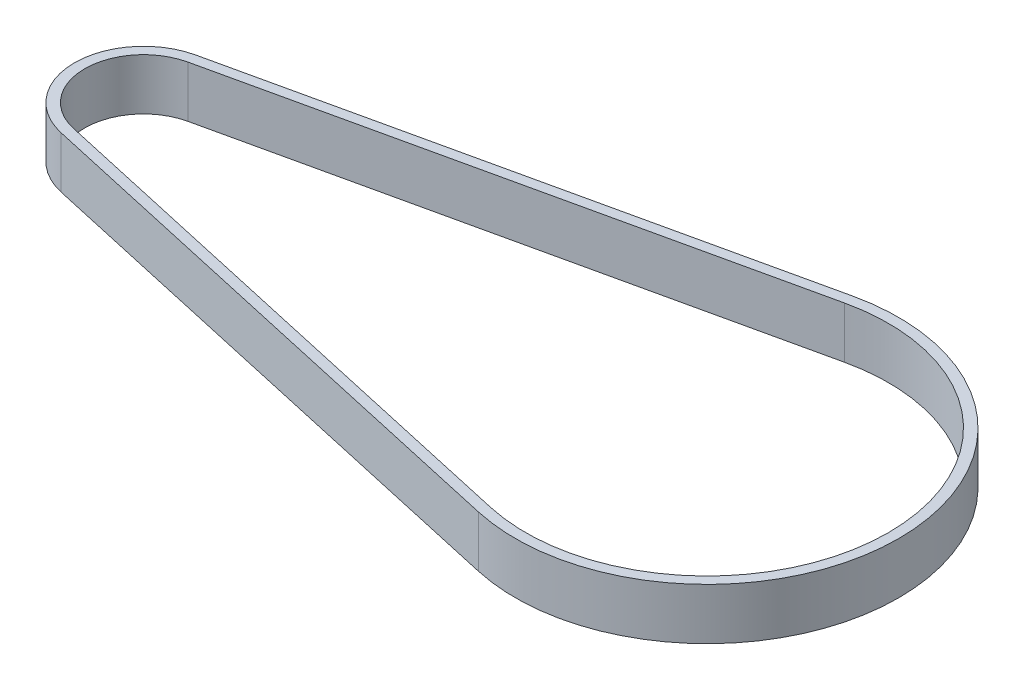
from build123d import *

# Parameters (mm, degrees)
LINEAR_AUSTRAGEN_D_NN1_DEPTH      = 2
LINEAR_AUSTRAGEN_D_NN1_DEPTH_BACK = 2


with BuildPart() as part:
    # Skizze1 → Linear-Austragen-Dünn1 (new, two sides: drawn at the far end of the back side and taken through both)
    with BuildSketch(Plane(origin=(0, 0, 0), x_dir=(1, 0, 0), z_dir=(0, 1, 0)).offset(-LINEAR_AUSTRAGEN_D_NN1_DEPTH_BACK)):
        with BuildLine():
            Line((40.65321754, -14.567567699), (-1.169276765, -5.246276474))
            ThreePointArc((-1.169276765, -5.246276474), (-5.375, 0), (-1.169276765, 5.246276474))
            Line((-1.169276765, 5.246276474), (40.65321754, 14.567567699))
            ThreePointArc((40.65321754, 14.567567699), (58.825, 0), (40.65321754, -14.567567699))
        make_face()
        with BuildLine():
            Line((40.827249431, -13.786726549), (-0.995244875, -4.465435325))
            ThreePointArc((-0.995244875, -4.465435325), (-4.575, 0), (-0.995244875, 4.465435325))
            Line((-0.995244875, 4.465435325), (40.827249431, 13.786726549))
            ThreePointArc((40.827249431, 13.786726549), (58.025, 0), (40.827249431, -13.786726549))
        make_face(mode=Mode.SUBTRACT)
    extrude(amount=LINEAR_AUSTRAGEN_D_NN1_DEPTH + LINEAR_AUSTRAGEN_D_NN1_DEPTH_BACK)


solid = part.part
